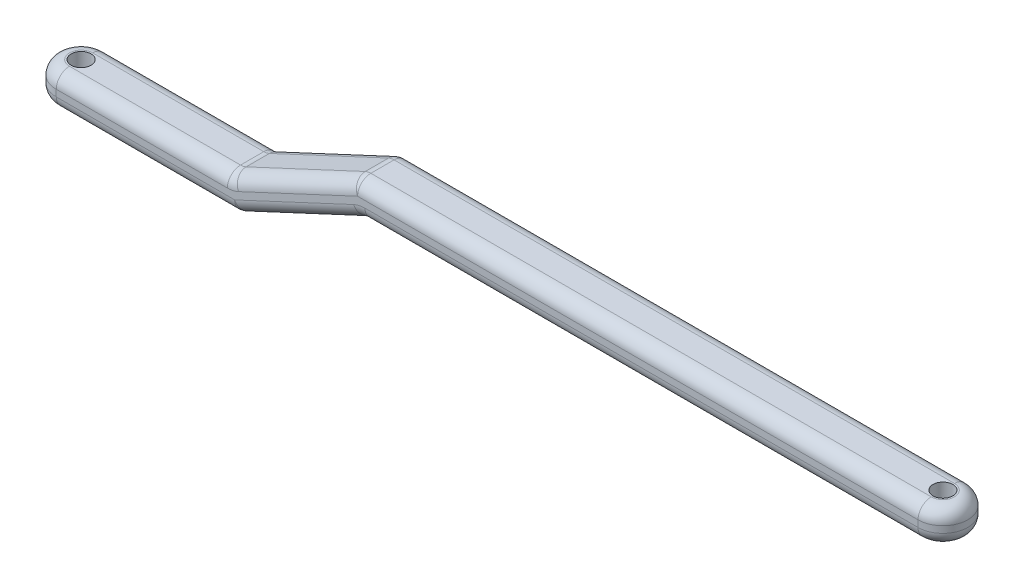
from build123d import *

# Parameters (mm, degrees)
CROQUIS1_R                 = 3
SALIENTE_EXTRUIR1_DEPTH    = 13.75
CORTAR_EXTRUIR1_DEPTH      = 268.958135723
CORTAR_EXTRUIR1_DEPTH_BACK = 268.958135723
CROQUIS3_OUTSIDE_W         = 84.856
CROQUIS3_OUTSIDE_H         = 332.356
REDONDEO5_R                = 4


with BuildPart() as part:
    # Croquis1 → Saliente-Extruir1 (new, symmetric)
    with BuildSketch(Plane(origin=(0, 0, 0), x_dir=(-1, 0, 0), z_dir=(0, 1, 0))):
        with BuildLine():
            Line((0, 7.5), (260, 7.5))
            ThreePointArc((260, 7.5), (267.5, 0), (260, -7.5))
            Line((260, -7.5), (0, -7.5))
            ThreePointArc((0, -7.5), (-7.5, 0), (0, 7.5))
        make_face()
        with Locations(Location((0, 0, 0), (0, 0, 90))):
            Circle(CROQUIS1_R, mode=Mode.SUBTRACT)
        with Locations(Location((260, 0, 0), (0, 0, 90))):
            Circle(CROQUIS1_R, mode=Mode.SUBTRACT)
    extrude(amount=SALIENTE_EXTRUIR1_DEPTH, both=True)

    # Croquis3 outside → Cortar-Extruir1 (cut, two sides: drawn at the far end of the back side and taken through both)
    with BuildSketch(Plane(origin=(0, 0, 0), x_dir=(0, 1, 0), z_dir=(0, 0, 1)).offset(-CORTAR_EXTRUIR1_DEPTH_BACK)):
        with Locations((0, 130)):
            Rectangle(CROQUIS3_OUTSIDE_W, CROQUIS3_OUTSIDE_H)
        Polygon((13.75, 169.971128891), (13.75, -7.5), (3.75, -7.5), (3.75, 167.754182265), (-13.75, 205.283053374), (-13.75, 267.5), (-3.75, 267.5), (-3.75, 207.5), align=None, mode=Mode.SUBTRACT)
    extrude(amount=CORTAR_EXTRUIR1_DEPTH + CORTAR_EXTRUIR1_DEPTH_BACK, mode=Mode.SUBTRACT)

    # Redondeo5
    redondeo5_edges = [part.edges().sort_by_distance(p)[0] for p in [
        (-84.985564446, 13.75, 7.5),
        (-232.641526687, -13.75, -7.5),
        (-186.518617819, -5, -7.5),
        (-83.877091132, 3.75, -7.5),
        (-167.754182265, 3.75, 0),
        (-83.877091132, 3.75, 7.5),
        (7.5, 3.75, 0),
        (-207.5, -3.75, 0),
        (-233.75, -3.75, 7.5),
        (-267.5, -3.75, 0),
        (-188.735564446, 5, -7.5),
        (-233.75, -3.75, -7.5),
        (-169.971128891, 13.75, 0),
        (-188.735564446, 5, 7.5),
        (-205.283053374, -13.75, 0),
        (-186.518617819, -5, 7.5),
        (7.5, 13.75, 0),
        (-232.641526687, -13.75, 7.5),
        (-267.5, -13.75, 0),
        (-84.985564446, 13.75, -7.5),
    ]]
    fillet(redondeo5_edges, radius=REDONDEO5_R)


solid = part.part
